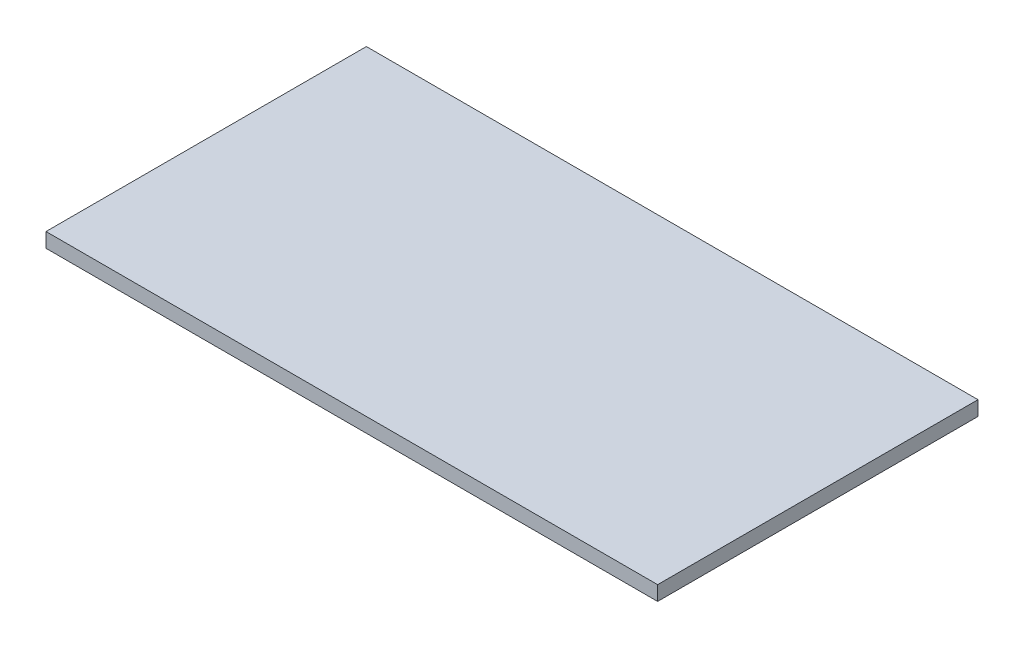
from build123d import *

# Parameters (mm, degrees)
SKETCH_1_W      = 533.4
SKETCH_1_H      = 279.4
EXTRUDE_1_DEPTH = 12.7


with BuildPart() as part:
    # 草图1 → 凸台-拉伸1 (new body)
    with BuildSketch(Plane(origin=(0, 0, 0), x_dir=(1, 0, 0), z_dir=(0, 1, 0))):
        with Locations((266.7, 139.7)):
            Rectangle(SKETCH_1_W, SKETCH_1_H)
    extrude(amount=EXTRUDE_1_DEPTH)


solid = part.part
